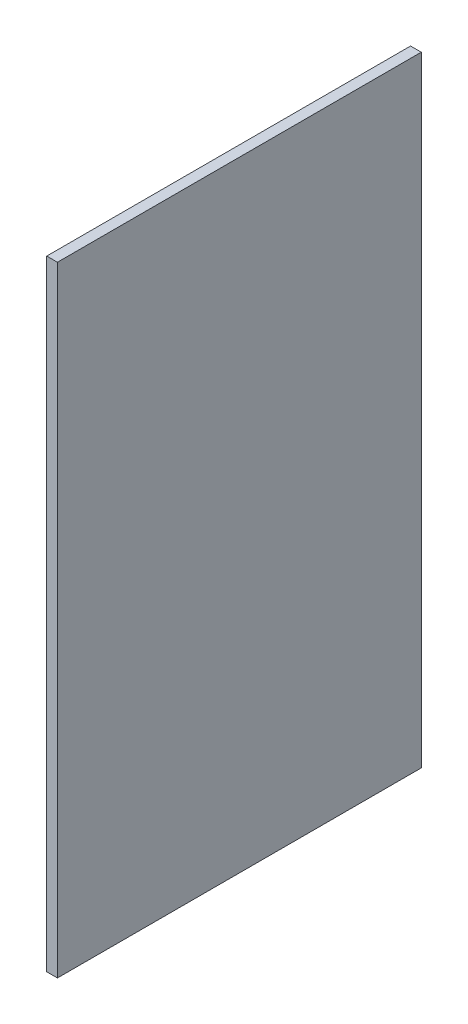
from build123d import *

# Parameters (mm, degrees)
SKETCH1_W           = 108
SKETCH1_H           = 184
BOSS_EXTRUDE1_DEPTH = 3.175


with BuildPart() as part:
    # Sketch1 → Boss-Extrude1 (new body)
    with BuildSketch(Plane(origin=(0, 0, 0), x_dir=(0, 0, -1), z_dir=(1, 0, 0))):
        Rectangle(SKETCH1_W, SKETCH1_H)
    extrude(amount=BOSS_EXTRUDE1_DEPTH)


solid = part.part
